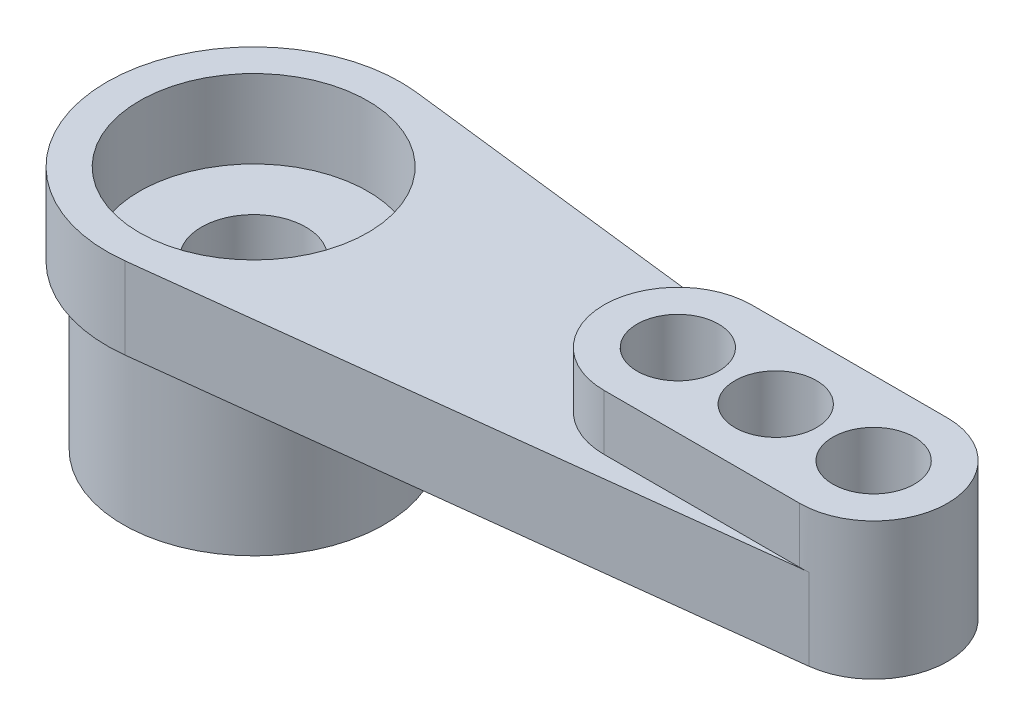
from build123d import *

# Parameters (mm, degrees)
BOSS_EXTRU_1_DEPTH                                 = 2.5
ESQUISSE2_R                                        = 4
BOSS_EXTRU_2_DEPTH                                 = 5
ESQUISSE3_R                                        = 2.7
ENL_V_MAT_EXTRU_1_DEPTH                            = 2.4
CHAMBRAGE_POUR_VIS_T_TE_RONDE_BOMB_E_M_D           = 3.2
CHAMBRAGE_POUR_VIS_T_TE_RONDE_BOMB_E_M_CBORE_D     = 7
CHAMBRAGE_POUR_VIS_T_TE_RONDE_BOMB_E_M_CBORE_DEPTH = 2.4
BOSS_EXTRU_3_DEPTH                                 = 1.7
DIAM_TRE_DU_PER_AGE_2_5_2_5_1_D                    = 2.5


with BuildPart() as part:
    # Esquisse1 → Boss.-Extru.1 (new body)
    with BuildSketch(Plane(origin=(0, 0, 0), x_dir=(1, 0, 0), z_dir=(0, 1, 0))):
        with BuildLine():
            Line((0.529171571, 4.468778071), (19.266434362, 2.25))
            ThreePointArc((19.266434362, 2.25), (21.265720033, 0), (19.266434362, -2.25))
            Line((19.266434362, -2.25), (0.529171571, -4.468778071))
            ThreePointArc((0.529171571, -4.468778071), (-4.5, 0), (0.529171571, 4.468778071))
        make_face()
    extrude(amount=BOSS_EXTRU_1_DEPTH)

    # Esquisse2 → Boss.-Extru.2 (add)
    with BuildSketch(Plane.XZ):
        Circle(ESQUISSE2_R)
    extrude(amount=BOSS_EXTRU_2_DEPTH)

    # Esquisse3 → Enlèv. mat.-Extru.1 (cut)
    with BuildSketch(Plane.XZ.offset(5)):
        Circle(ESQUISSE3_R)
    extrude(amount=-ENL_V_MAT_EXTRU_1_DEPTH, mode=Mode.SUBTRACT)

    # Chambrage pour vis à tête ronde bombée M31 (through all)
    with Locations(Plane(origin=(0, 2.5, 0), x_dir=(1, 0, 0), z_dir=(0, 1, 0))):
        with Locations((0, 0)):
            CounterBoreHole(CHAMBRAGE_POUR_VIS_T_TE_RONDE_BOMB_E_M_D / 2, CHAMBRAGE_POUR_VIS_T_TE_RONDE_BOMB_E_M_CBORE_D / 2, CHAMBRAGE_POUR_VIS_T_TE_RONDE_BOMB_E_M_CBORE_DEPTH)

    # Esquisse6 → Boss.-Extru.3 (add)
    with BuildSketch(Plane(origin=(0, 2.5, 0), x_dir=(1, 0, 0), z_dir=(0, 1, 0))):
        with BuildLine():
            Line((19, -2.265720033), (13, -2.265720033))
            ThreePointArc((13, -2.265720033), (10.734279967, 0), (13, 2.265720033))
            Line((13, 2.265720033), (19, 2.265720033))
            ThreePointArc((19, 2.265720033), (21.265720033, 0), (19, -2.265720033))
        make_face()
    extrude(amount=BOSS_EXTRU_3_DEPTH)

    # Diamètre du perçage Ø2.5 (2.5)1 (through all)
    with Locations(Plane(origin=(0, 4.2, 0), x_dir=(1, 0, 0), z_dir=(0, 1, 0))):
        with Locations((13, 0), (16, 0), (19, 0)):
            Hole(DIAM_TRE_DU_PER_AGE_2_5_2_5_1_D / 2)


solid = part.part
